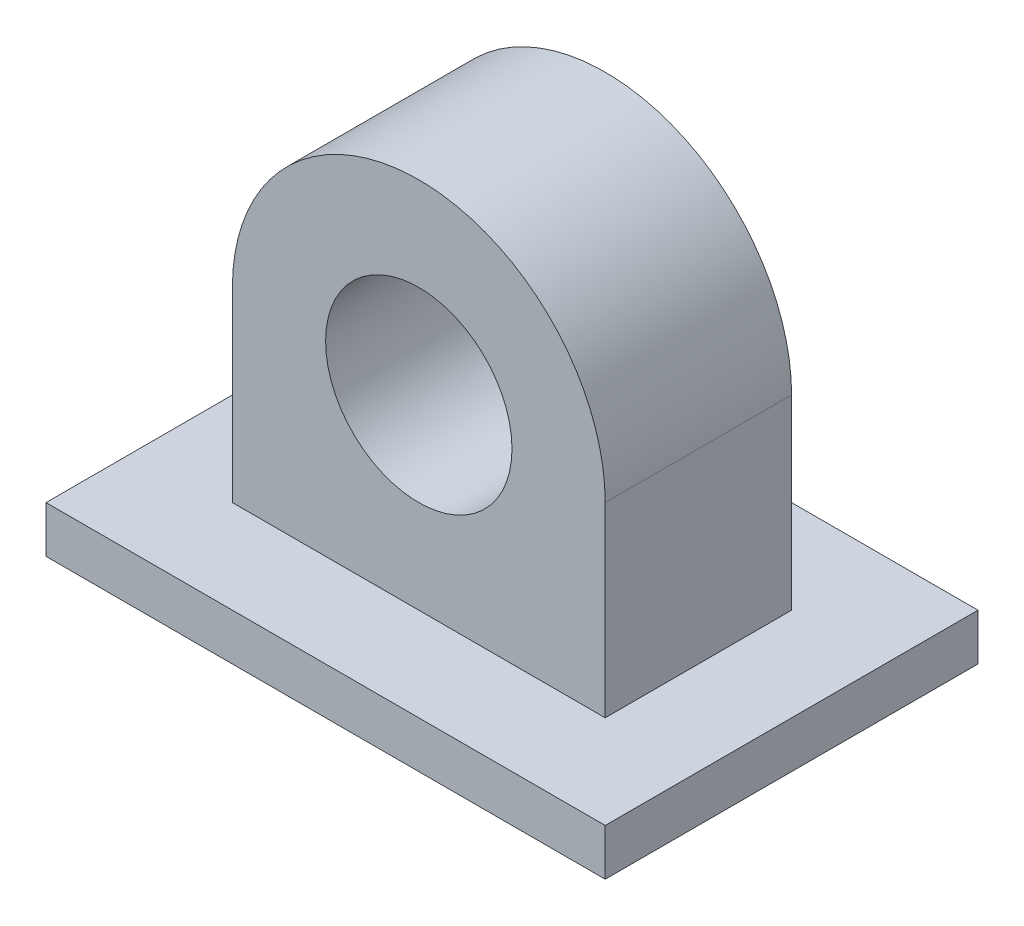
from build123d import *

# Parameters (mm, degrees)
SKETCH1_W           = 76.2
SKETCH1_H           = 50.8
BOSS_EXTRUDE1_DEPTH = 6.35
SKETCH2_W           = 50.8
SKETCH2_H           = 25.4
BOSS_EXTRUDE2_DEPTH = 12.7
SKETCH3_R           = 12.7
CUT_EXTRUDE1_DEPTH  = 79.545162168


with BuildPart() as part:
    # Sketch1 → Boss-Extrude1 (new body)
    with BuildSketch(Plane(origin=(0, 0, 0), x_dir=(1, 0, 0), z_dir=(0, 1, 0))):
        Rectangle(SKETCH1_W, SKETCH1_H)
    extrude(amount=BOSS_EXTRUDE1_DEPTH)

    # Sketch2 → Boss-Extrude2 (add, symmetric)
    with BuildSketch(Plane.XY):
        with BuildLine():
            ThreePointArc((-25.4, 31.75), (0, 57.15), (25.4, 31.75))
            Line((25.4, 31.75), (-25.4, 31.75))
        make_face()
        with Locations((0, 19.05)):
            Rectangle(SKETCH2_W, SKETCH2_H)
    extrude(amount=BOSS_EXTRUDE2_DEPTH, both=True)

    # Sketch3 → Cut-Extrude1 (cut, through all)
    with BuildSketch(Plane.XY.offset(12.7)):
        with Locations((0, 31.75)):
            Circle(SKETCH3_R)
    extrude(amount=-CUT_EXTRUDE1_DEPTH, mode=Mode.SUBTRACT)


solid = part.part
